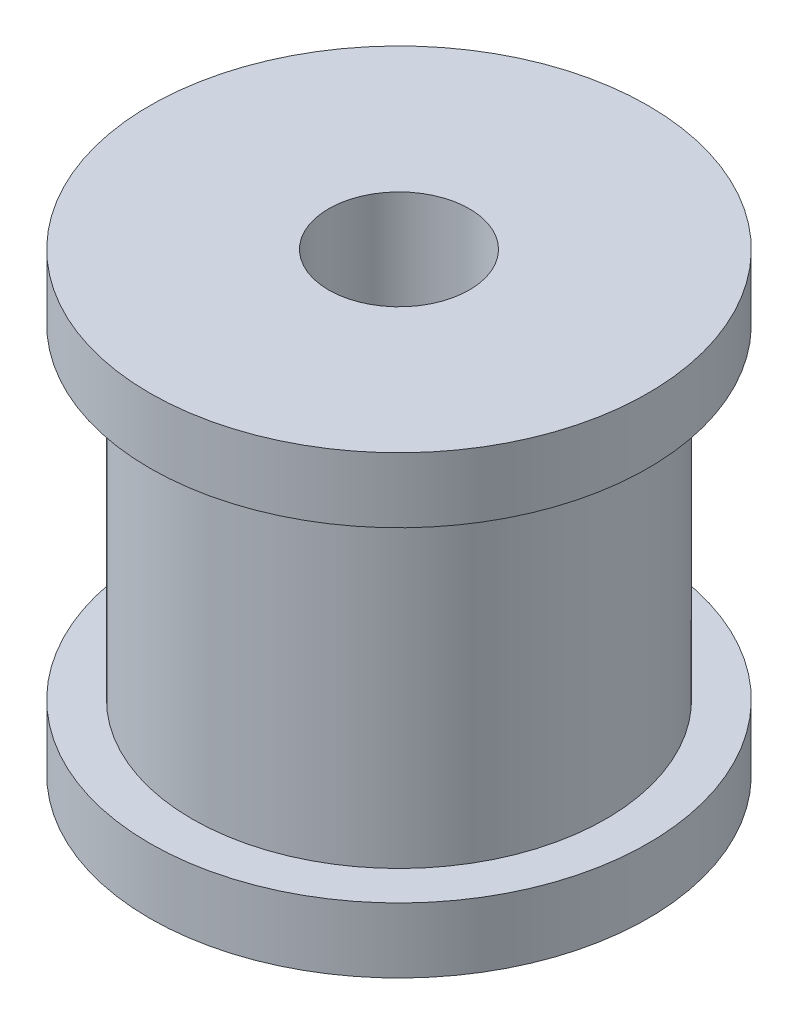
from build123d import *

# Parameters (mm, degrees)
SKETCH1_R           = 11.5
SKETCH1_R_2         = 3.25
BOSS_EXTRUDE1_DEPTH = 3
SKETCH2_R           = 9.55
SKETCH2_R_2         = 3.25
BOSS_EXTRUDE2_DEPTH = 15
SKETCH3_R           = 11.5
SKETCH3_R_2         = 3.25
BOSS_EXTRUDE3_DEPTH = 3


with BuildPart() as part:
    # Sketch1 → Boss-Extrude1 (new body)
    with BuildSketch(Plane(origin=(0, 0, 0), x_dir=(1, 0, 0), z_dir=(0, 1, 0))):
        with Locations(Location((0, 0, 0), (0, 0, 270))):
            Circle(SKETCH1_R)
        with Locations(Location((0, 0, 0), (0, 0, 270))):
            Circle(SKETCH1_R_2, mode=Mode.SUBTRACT)
    extrude(amount=BOSS_EXTRUDE1_DEPTH)

    # Sketch2 → Boss-Extrude2 (add)
    with BuildSketch(Plane(origin=(0, 3, 0), x_dir=(1, 0, 0), z_dir=(0, 1, 0))):
        with Locations(Location((0, 0, 0), (0, 0, 270))):
            Circle(SKETCH2_R)
        with Locations(Location((0, 0, 0), (0, 0, 270))):
            Circle(SKETCH2_R_2, mode=Mode.SUBTRACT)
    extrude(amount=BOSS_EXTRUDE2_DEPTH)

    # Sketch3 → Boss-Extrude3 (add)
    with BuildSketch(Plane(origin=(0, 18, 0), x_dir=(1, 0, 0), z_dir=(0, 1, 0))):
        with Locations(Location((0, 0, 0), (0, 0, 270))):
            Circle(SKETCH3_R)
        with Locations(Location((0, 0, 0), (0, 0, 270))):
            Circle(SKETCH3_R_2, mode=Mode.SUBTRACT)
    extrude(amount=BOSS_EXTRUDE3_DEPTH)


solid = part.part
